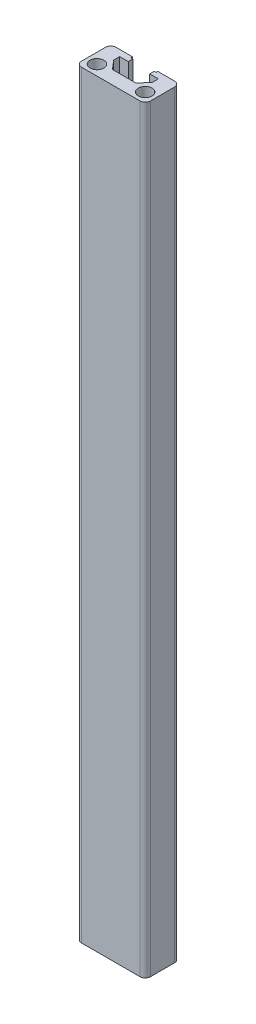
from build123d import *

# Parameters (mm, degrees)
SKETCH_1_R      = 2
EXTRUDE_1_DEPTH = 220
FILLET_1_R      = 1.5


with BuildPart() as part:
    # 草图1 → 凸台-拉伸1 (new body)
    with BuildSketch(Plane(origin=(0, 0, 0), x_dir=(1, 0, 0), z_dir=(0, 1, 0))):
        Polygon((0, 0), (20, 0), (20, 10), (13.65, 10), (13.65, 9.510427602), (13.1, 9.510427602), (13.1, 8.2), (15.6, 8.2), (15.6, 6.447507136), (13.412706863, 3.9), (6.587293137, 3.9), (4.4, 6.447507136), (4.4, 8.2), (6.9, 8.2), (6.9, 9.510427602), (6.35, 9.510427602), (6.35, 10), (0, 10), align=None)
        with Locations(Location((3, 3, 0), (0, 0, 270))):
            Circle(SKETCH_1_R, mode=Mode.SUBTRACT)
        with Locations(Location((17, 3, 0), (0, 0, 270))):
            Circle(SKETCH_1_R, mode=Mode.SUBTRACT)
    extrude(amount=EXTRUDE_1_DEPTH)

    # 圆角1
    fillet_1_edges = [part.edges().sort_by_distance(p)[0] for p in [
        (0, 110, -10),
        (20, 110, -10),
        (20, 110, 0),
        (0, 110, 0),
    ]]
    fillet(fillet_1_edges, radius=FILLET_1_R)


solid = part.part
